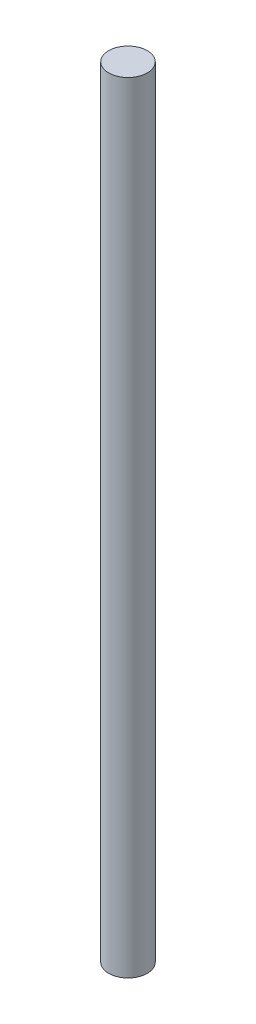
from build123d import *

# Parameters (mm, degrees)
SKETCH1_R           = 7.5
BOSS_EXTRUDE1_DEPTH = 303


with BuildPart() as part:
    # Sketch1 → Boss-Extrude1 (new body)
    with BuildSketch(Plane(origin=(0, 0, 0), x_dir=(1, 0, 0), z_dir=(0, 1, 0))):
        with Locations(Location((0, 0, 0), (0, 0, 270))):
            Circle(SKETCH1_R)
    extrude(amount=BOSS_EXTRUDE1_DEPTH)


solid = part.part
